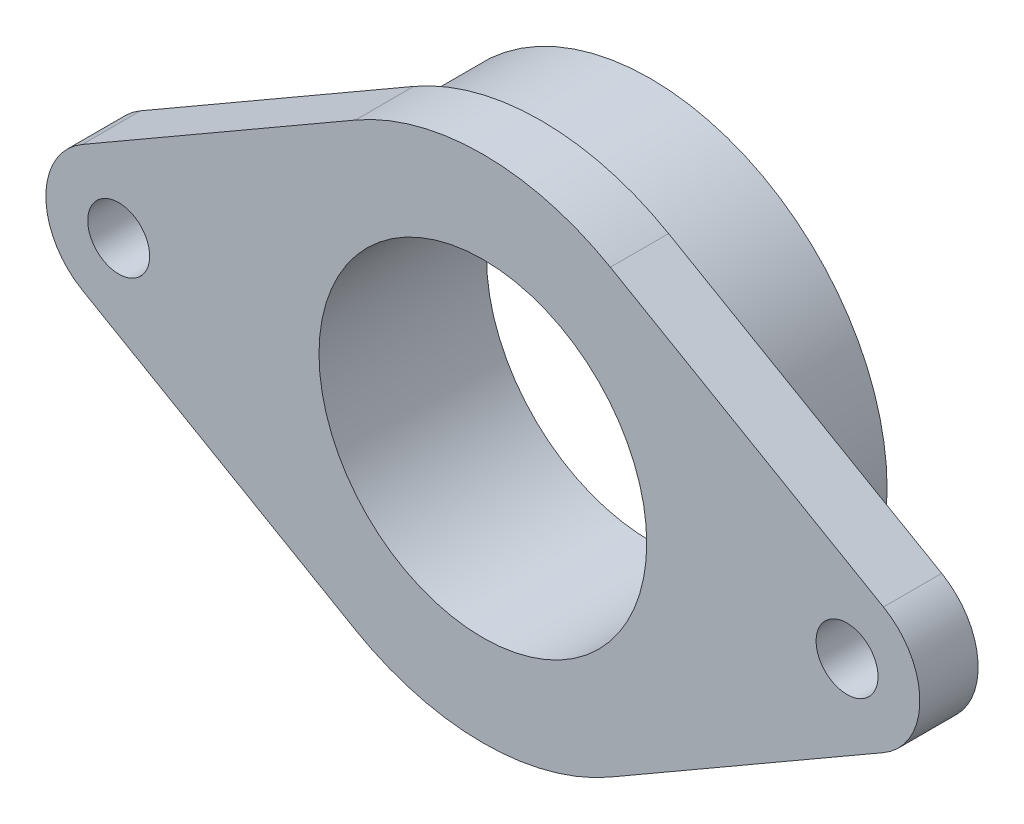
from build123d import *
from build123d.topology import SkipClean

# Parameters (mm, degrees)
SKETCH2_R           = 22.5
SKETCH2_R_2         = 4.25
BOSS_EXTRUDE1_DEPTH = 8
BOSS_EXTRUDE2_START = 15
SKETCH3_R           = 32.5
SKETCH3_R_2         = 22.5
BOSS_EXTRUDE2_DEPTH = 15


with BuildPart() as part:
    # Sketch2 → Boss-Extrude1 (new body)
    with BuildSketch(Plane.XY):
        with BuildLine():
            Line((-55, 8.660254038), (-17.5, 30.310889132))
            ThreePointArc((-17.5, 30.310889132), (0, 35), (17.5, 30.310889132))
            Line((17.5, 30.310889132), (55, 8.660254038))
            ThreePointArc((55, 8.660254038), (60, 0), (55, -8.660254038))
            Line((55, -8.660254038), (17.5, -30.310889132))
            ThreePointArc((17.5, -30.310889132), (0, -35), (-17.5, -30.310889132))
            Line((-17.5, -30.310889132), (-55, -8.660254038))
            ThreePointArc((-55, -8.660254038), (-60, 0), (-55, 8.660254038))
        make_face()
        Circle(SKETCH2_R, mode=Mode.SUBTRACT)
        with Locations((50, 0)):
            Circle(SKETCH2_R_2, mode=Mode.SUBTRACT)
        with Locations((-50, 0)):
            Circle(SKETCH2_R_2, mode=Mode.SUBTRACT)
    extrude(amount=BOSS_EXTRUDE1_DEPTH)

    # Sketch3 → Boss-Extrude2 (add)
    with SkipClean():  # the faces are left unmerged after this step: merging them gives an invalid solid
        with BuildSketch(Plane(origin=(0, 0, 0), x_dir=(-1, 0, 0), z_dir=(0, 0, -1)).offset(BOSS_EXTRUDE2_START)):
            with Locations(Location((0, 0, 0), (0, 0, 180))):
                Circle(SKETCH3_R)
            Circle(SKETCH3_R_2, mode=Mode.SUBTRACT)
        extrude(amount=-BOSS_EXTRUDE2_DEPTH)


solid = part.part
